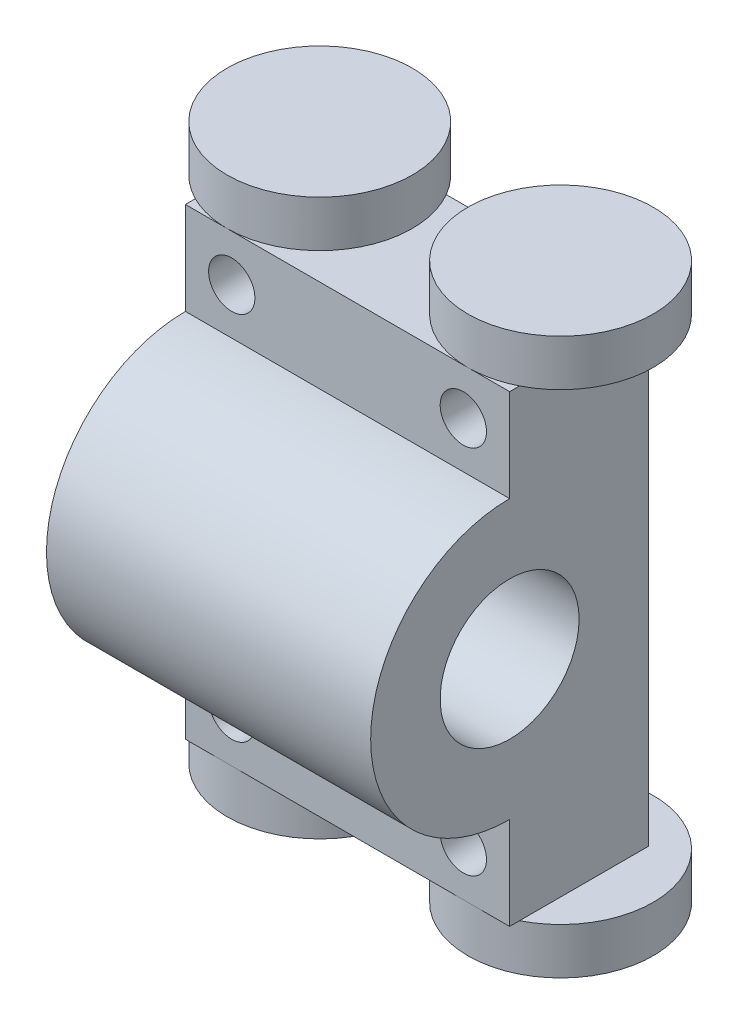
from build123d import *

# Parameters (mm, degrees)
BODY_DEPTH              = 35
SKETCH3_R               = 7.5
SHAFT_HOLE_DEPTH        = 40
SKETCH4_R               = 2.5
BOSS_EXTRUDE1_DEPTH     = 5
SKETCH5_R               = 10
BEARING_DEPTH           = 5
MIRROR5_COPY_1_SKETCH_R = 10
MIRROR5_COPY_1_DEPTH    = 5
SKETCH6_R               = 2.5
CUT_EXTRUDE1_DEPTH      = 55.224072145


with BuildPart() as part:
    # Sketch1 → body (new body)
    with BuildSketch(Plane(origin=(0, 0, 0), x_dir=(0, 0, -1), z_dir=(1, 0, 0))):
        with BuildLine():
            Line((-15, -15), (-15, -25))
            Line((-15, -25), (0, -25))
            Line((0, -25), (0, 25))
            Line((0, 25), (-15, 25))
            Line((-15, 25), (-15, 15))
            ThreePointArc((-15, 15), (-30, 0), (-15, -15))
        make_face()
    extrude(amount=BODY_DEPTH)

    # Sketch3 → shaft hole (cut)
    with BuildSketch(Plane(origin=(35, 0, 0), x_dir=(0, 0, -1), z_dir=(1, 0, 0))):
        with Locations((-15, 0)):
            Circle(SKETCH3_R)
    extrude(amount=-SHAFT_HOLE_DEPTH, mode=Mode.SUBTRACT)

    # Sketch4 → Boss-Extrude1 (add)
    with BuildSketch(Plane(origin=(0, 25, 0), x_dir=(1, 0, 0), z_dir=(0, 1, 0))):
        with Locations(Location((4.5, -5, 0), (0, 0, 90))):
            Circle(SKETCH4_R)
        with Locations(Location((30.5, -5, 0), (0, 0, 90))):
            Circle(SKETCH4_R)
    boss_extrude1 = extrude(amount=BOSS_EXTRUDE1_DEPTH)

    # Mirror1: Boss-Extrude1 across plane
    add(boss_extrude1.mirror(Plane.ZX))

    # Sketch5 → bearing (add)
    with BuildSketch(Plane(origin=(0, 30, 0), x_dir=(1, 0, 0), z_dir=(0, 1, 0))):
        with Locations(Location((4.5, -5, 0), (0, 0, 270))):
            Circle(SKETCH5_R)
    bearing = extrude(amount=-BEARING_DEPTH)

    # Mirror2: bearing across plane
    add(bearing.mirror(Plane.ZX))

    # Mirror5: bearing across plane
    add(bearing.mirror(Plane(origin=(17.5, 0, 0), x_dir=(0, 0, 1), z_dir=(1, 0, 0))))

    # Mirror5 copy 1 sketch → Mirror5 copy 1 (add)
    with BuildSketch(Plane(origin=(35, -30, 0), x_dir=(-1, 0, 0), z_dir=(0, -1, 0))):
        with Locations(Location((4.5, -5, 0), (0, 0, 270))):
            Circle(MIRROR5_COPY_1_SKETCH_R)
    extrude(amount=-MIRROR5_COPY_1_DEPTH)

    # Sketch6 → Cut-Extrude1 (cut, through all)
    with BuildSketch(Plane.XY.offset(15)):
        with Locations((5, 20)):
            Circle(SKETCH6_R)
        with Locations((30, 20)):
            Circle(SKETCH6_R)
        with Locations((30, -20)):
            Circle(SKETCH6_R)
        with Locations((5, -20)):
            Circle(SKETCH6_R)
    extrude(amount=-CUT_EXTRUDE1_DEPTH, mode=Mode.SUBTRACT)


solid = part.part
